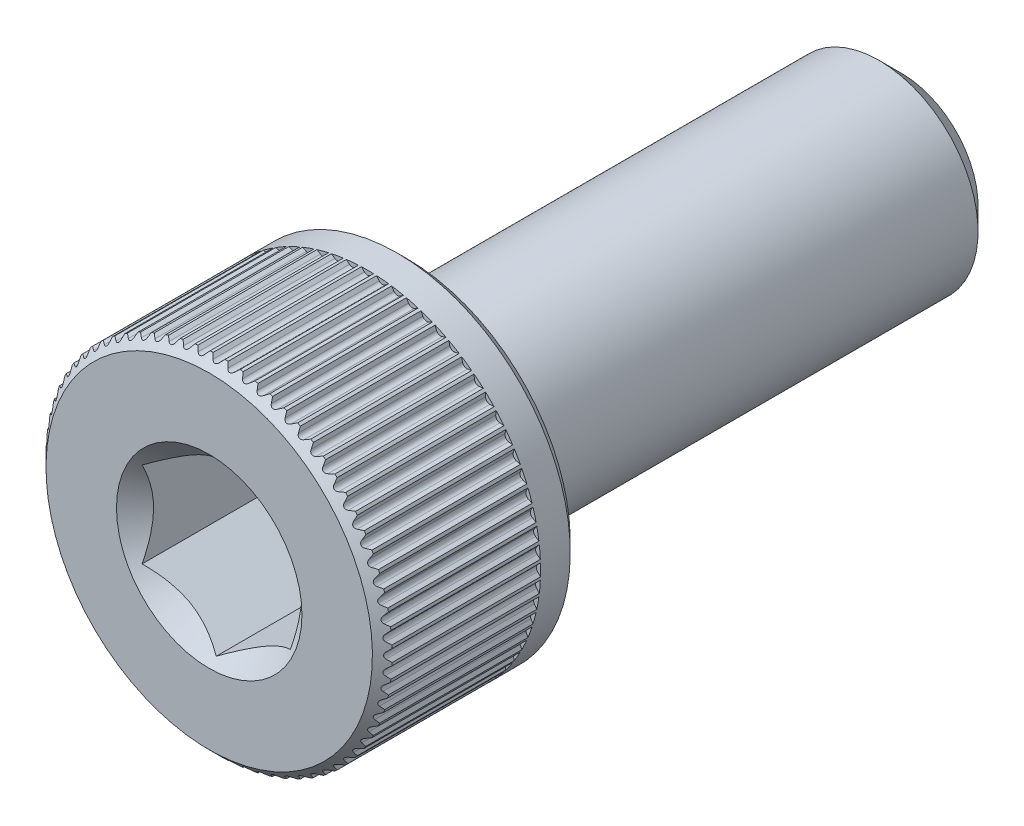
from build123d import *

# Parameters (mm, degrees)
CUT_EXTRUDE1_DEPTH = 3
CUT_EXTRUDE3_DEPTH = 3.2
CIRPATTERN1_COUNT  = 72


with BuildPart() as part:
    # Sketch2 → Revolve1 (revolve)
    with BuildSketch(Plane(origin=(0, 0, 0), x_dir=(0, 0, -1), z_dir=(1, 0, 0))):
        with BuildLine():
            Line((-7, 0), (-7, 3.3))
            Line((-7, 3.3), (-6.8, 3.5))
            Line((-6.8, 3.5), (-3.2, 3.5))
            Line((-3.2, 3.5), (-3, 3.3))
            Line((-3, 3.3), (-3, 2.2))
            ThreePointArc((-3, 2.2), (-2.941421356, 2.058578644), (-2.8, 2))
            Line((-2.8, 2), (6.545336663, 2))
            Line((6.545336663, 2), (7, 1.545336663))
            Line((7, 1.545336663), (7, 0))
            Line((7, 0), (-7, 0))
        make_face()
    revolve(axis=Axis((0, 0, -7), (0, 0, 1)))

    # Sketch3 → Cut-Extrude1 (cut)
    with BuildSketch(Plane.XY.offset(7)):
        Polygon((1.5, -0.866025404), (1.5, 0.866025404), (0, 1.732050808), (-1.5, 0.866025404), (-1.5, -0.866025404), (0, -1.732050808), align=None)
    extrude(amount=-CUT_EXTRUDE1_DEPTH, mode=Mode.SUBTRACT)

    # Cut-Extrude2 cone 1 section (through the dimple's axis) → Cut-Extrude2 (revolve, cut)
    with BuildSketch(Plane(origin=(0, 0, 7), x_dir=(0, -1, 0), z_dir=(1, 0, 0))):
        Polygon((0, 0), (1.875, 0), (0, 1.875), align=None)
    revolve(axis=Axis((0, 0, 7), (0, 0, -1)), mode=Mode.SUBTRACT)

    # Sketch12 → Cut-Extrude3 (cut)
    with BuildSketch(Plane.XY.offset(7)):
        with BuildLine():
            Line((-0.211780344, 3.5875), (0.211780344, 3.5875))
            Line((0.211780344, 3.5875), (0.062787974, 3.438507631))
            ThreePointArc((0.062787974, 3.438507631), (0, 3.4125), (-0.062787974, 3.438507631))
            Line((-0.062787974, 3.438507631), (-0.211780344, 3.5875))
        make_face()
    cut_extrude3 = extrude(amount=-CUT_EXTRUDE3_DEPTH, mode=Mode.SUBTRACT)

    # CirPattern1: Cut-Extrude3 ×72 about axis
    cirpattern1_axis = Axis((0, 0, 0), (0, 0, 1))
    for i in range(1, CIRPATTERN1_COUNT):
        add(cut_extrude3.rotate(cirpattern1_axis, i * 360 / CIRPATTERN1_COUNT), mode=Mode.SUBTRACT)


solid = part.part
